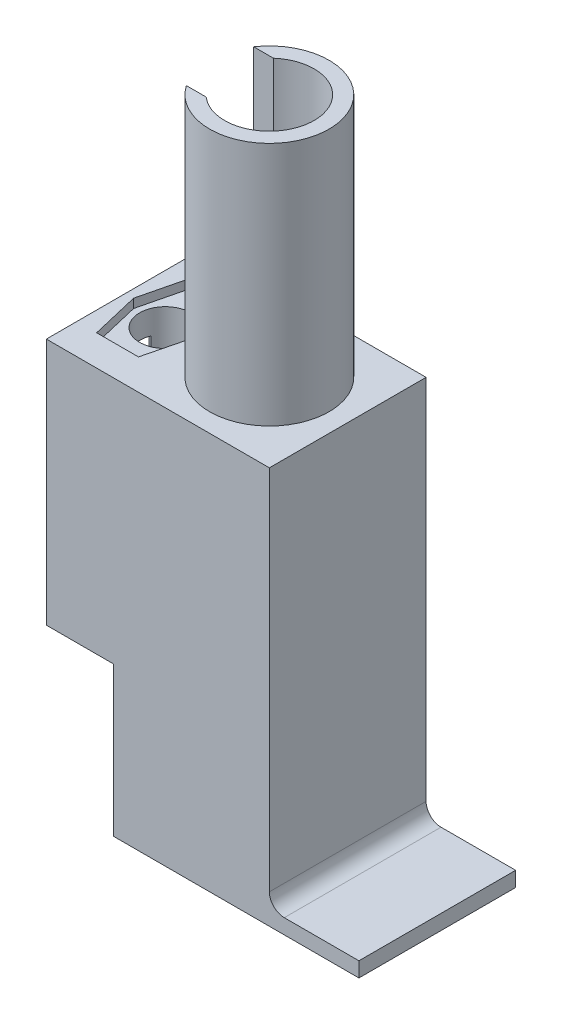
from build123d import *

# Parameters (mm, degrees)
SKETCH1_W                = 74.7
SKETCH1_H                = 52.5
BOSS_EXTRUDE1_DEPTH      = 83
SKETCH4_W                = 42.5
SKETCH4_H                = 42.5
CUT_EXTRUDE1_DEPTH       = 24
SKETCH7_R                = 8.6
CUT_EXTRUDE6_DEPTH       = 130
CUT_EXTRUDE16_DEPTH      = 115.708990493
CUT_EXTRUDE16_DEPTH_BACK = 4.99
SKETCH13_W               = 45.5
SKETCH13_H               = 61
SKETCH15_W               = 6.385819608
SKETCH15_H               = 61
CUT_EXTRUDE17_DEPTH      = 1
SKETCH18_W               = 42.5
SKETCH18_H               = 42.5
BOSS_EXTRUDE2_DEPTH      = 31
SKETCH19_W               = 52.25
SKETCH19_H               = 52.5
BOSS_EXTRUDE3_DEPTH      = 50
SKETCH20_W               = 42.5
SKETCH20_H               = 42.5
CUT_EXTRUDE19_DEPTH      = 23.5
SKETCH21_W               = 52.5
SKETCH21_H               = 5
BOSS_EXTRUDE4_DEPTH      = 30
FILLET1_R                = 5
SKETCH22_R               = 15
CUT_EXTRUDE20_DEPTH      = 120
CUT_EXTRUDE21_DEPTH      = 3
SKETCH24_R               = 20
SKETCH24_R_2             = 15
BOSS_EXTRUDE5_DEPTH      = 82
CUT_EXTRUDE22_START      = -82
CUT_EXTRUDE22_DEPTH      = 82


with BuildPart() as part:
    # Sketch1 → Boss-Extrude1 (new body)
    with BuildSketch(Plane(origin=(0, 0, 0), x_dir=(1, 0, 0), z_dir=(0, 1, 0))):
        Rectangle(SKETCH1_W, SKETCH1_H)
    extrude(amount=BOSS_EXTRUDE1_DEPTH)

    # Sketch4 → Cut-Extrude1 (cut)
    with BuildSketch(Plane.XZ):
        with Locations((11.1, 0)):
            Rectangle(SKETCH4_W, SKETCH4_H)
    extrude(amount=-CUT_EXTRUDE1_DEPTH, mode=Mode.SUBTRACT)

    # Sketch7 → Cut-Extrude6 (cut)
    with BuildSketch(Plane.XZ):
        with Locations(Location((-23.75, 0, 0), (0, 0, 270))):
            Circle(SKETCH7_R)
    extrude(amount=-CUT_EXTRUDE6_DEPTH, mode=Mode.SUBTRACT)

    # Sketch13 → Cut-Extrude16 (cut, two sides: drawn at the far end of the back side and taken through both)
    with BuildSketch(Plane.ZY.offset(37.35).offset(-CUT_EXTRUDE16_DEPTH_BACK)):
        with Locations((0, 41.5)):
            Rectangle(SKETCH13_W, SKETCH13_H)
    extrude(amount=CUT_EXTRUDE16_DEPTH + CUT_EXTRUDE16_DEPTH_BACK, mode=Mode.SUBTRACT)

    # Sketch15 → Cut-Extrude17 (cut)
    with BuildSketch(Plane.ZY.offset(32.36)):
        with Locations((0, 41.5)):
            Rectangle(SKETCH15_W, SKETCH15_H)
    extrude(amount=-CUT_EXTRUDE17_DEPTH, mode=Mode.SUBTRACT)

    # Sketch18 → Boss-Extrude2 (add)
    with BuildSketch(Plane.XZ):
        with Locations((11.1, 0)):
            Rectangle(SKETCH18_W, SKETCH18_H)
    extrude(amount=-BOSS_EXTRUDE2_DEPTH)

    # Sketch19 → Boss-Extrude3 (add)
    with BuildSketch(Plane.XZ):
        with Locations((11.225, 0)):
            Rectangle(SKETCH19_W, SKETCH19_H)
    extrude(amount=BOSS_EXTRUDE3_DEPTH)

    # Sketch20 → Cut-Extrude19 (cut)
    with BuildSketch(Plane.XZ.offset(50)):
        with Locations((11.1, 0)):
            Rectangle(SKETCH20_W, SKETCH20_H)
    extrude(amount=-CUT_EXTRUDE19_DEPTH, mode=Mode.SUBTRACT)

    # Sketch21 → Boss-Extrude4 (add)
    with BuildSketch(Plane(origin=(37.35, 0, 0), x_dir=(0, 0, -1), z_dir=(1, 0, 0))):
        with Locations((0, -47.5)):
            Rectangle(SKETCH21_W, SKETCH21_H)
    extrude(amount=BOSS_EXTRUDE4_DEPTH)

    # Fillet1
    fillet1_edges = [part.edges().sort_by_distance(p)[0] for p in [
        (37.35, -45, 0),
    ]]
    fillet(fillet1_edges, radius=FILLET1_R)

    # Sketch22 → Cut-Extrude20 (cut)
    with BuildSketch(Plane.XZ.offset(26.5)):
        with Locations(Location((11.1, 0, 0), (0, 0, 270))):
            Circle(SKETCH22_R)
    extrude(amount=-CUT_EXTRUDE20_DEPTH, mode=Mode.SUBTRACT)

    # Sketch23 → Cut-Extrude21 (cut)
    with BuildSketch(Plane(origin=(0, 83, 0), x_dir=(1, 0, 0), z_dir=(0, 1, 0))):
        Polygon((-16.75, 16), (-12.788538026, -0.140014893), (-16.75, -16), (-30.75, -16), (-34.596459266, 0.235543482), (-30.75, 16), align=None)
    extrude(amount=-CUT_EXTRUDE21_DEPTH, mode=Mode.SUBTRACT)

    # Sketch24 → Boss-Extrude5 (add)
    with BuildSketch(Plane(origin=(0, 83, 0), x_dir=(1, 0, 0), z_dir=(0, 1, 0))):
        with Locations(Location((11.1, 0, 0), (0, 0, 270))):
            Circle(SKETCH24_R)
        with Locations(Location((11.1, 0, 0), (0, 0, 90))):
            Circle(SKETCH24_R_2, mode=Mode.SUBTRACT)
    extrude(amount=BOSS_EXTRUDE5_DEPTH)

    # Sketch27 → Cut-Extrude22 (cut)
    with BuildSketch(Plane(origin=(0, 165, 0), x_dir=(1, 0, 0), z_dir=(0, 1, 0)).offset(CUT_EXTRUDE22_START)):
        with BuildLine():
            Line((-5.423226258, 11.268673126), (1.199646169, 11.268673126))
            ThreePointArc((1.199646169, 11.268673126), (-3.9, 0), (1.199646169, -11.268673126))
            Line((1.199646169, -11.268673126), (-5.423226258, -11.268673126))
            ThreePointArc((-5.423226258, -11.268673126), (-8.9, 0), (-5.423226258, 11.268673126))
        make_face()
    extrude(amount=CUT_EXTRUDE22_DEPTH, mode=Mode.SUBTRACT)


solid = part.part
